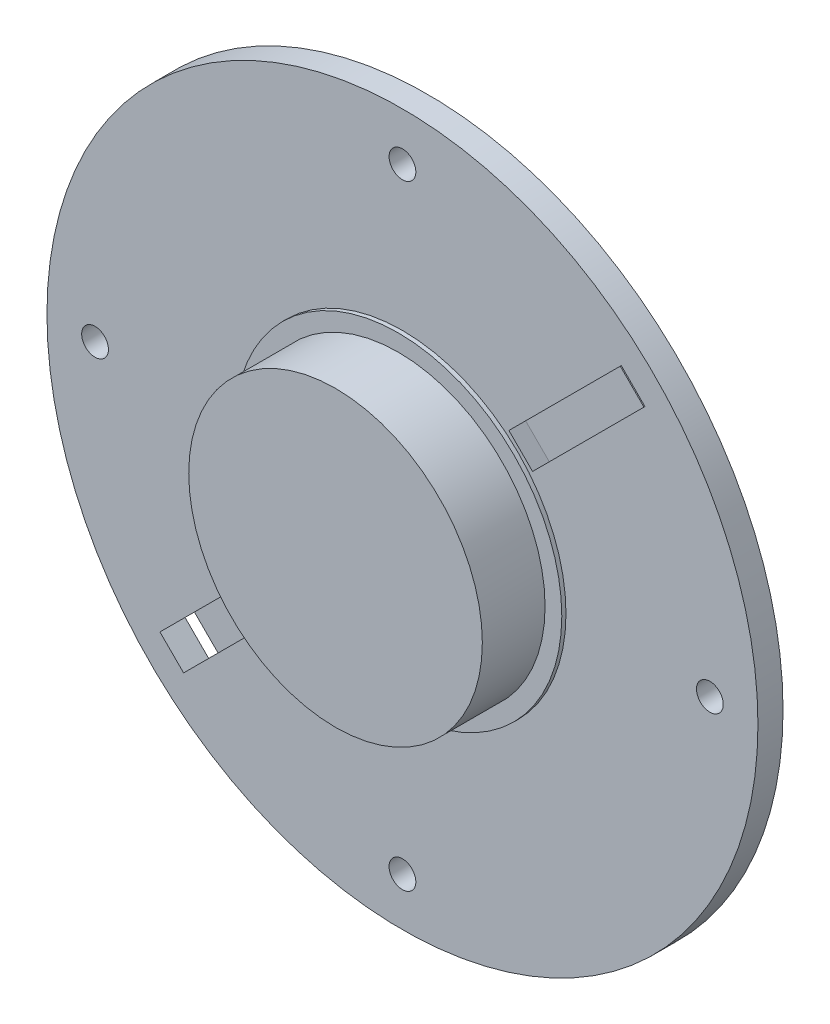
from build123d import *

# Parameters (mm, degrees)
SKETCH2_R           = 1.6
CUT_EXTRUDE1_DEPTH  = 62.102373113
SKETCH8_R           = 10
CUT_EXTRUDE6_DEPTH  = 2
SKETCH16_R          = 1.5
CUT_EXTRUDE7_DEPTH  = 4
CUT_EXTRUDE10_DEPTH = 2


with BuildPart() as part:
    # Sketch1 → Revolve1 (revolve)
    with BuildSketch(Plane(origin=(0, 0, 0), x_dir=(0, 0, -1), z_dir=(1, 0, 0)), mode=Mode.PRIVATE) as revolve1_sk:
        Polygon((0, 0), (0, 42.5), (-3, 42.5), (-3, 19.55), (-3.5, 19.55), (-3.5, 17.55), (-11, 17.55), (-11, 0), align=None)
    revolve(revolve1_sk.sketch.rotate(Axis((0, 0, 11), (0, 0, -1)), 90), axis=Axis((0, 0, 11), (0, 0, -1)))

    # Sketch2 → Cut-Extrude1 (cut, through all)
    with BuildSketch(Plane(origin=(0, 0, 0), x_dir=(-1, 0, 0), z_dir=(0, 0, -1))):
        with Locations(Location((0, 36.75, 0), (0, 0, 90))):
            Circle(SKETCH2_R)
        with Locations(Location((36.75, 0, 0), (0, 0, 90))):
            Circle(SKETCH2_R)
        with Locations(Location((0, -36.75, 0), (0, 0, 90))):
            Circle(SKETCH2_R)
        with Locations(Location((-36.75, 0, 0), (0, 0, 90))):
            Circle(SKETCH2_R)
    extrude(amount=-CUT_EXTRUDE1_DEPTH, mode=Mode.SUBTRACT)

    # Sketch8 → Cut-Extrude6 (cut)
    with BuildSketch(Plane(origin=(0, 0, 0), x_dir=(-1, 0, 0), z_dir=(0, 0, -1))):
        Circle(SKETCH8_R)
    extrude(amount=-CUT_EXTRUDE6_DEPTH, mode=Mode.SUBTRACT)

    # Sketch16 → Cut-Extrude7 (cut)
    with BuildSketch(Plane(origin=(0, 0, 2), x_dir=(-1, 0, 0), z_dir=(0, 0, -1))):
        with Locations((4.065863992, 4.065863992)):
            Circle(SKETCH16_R)
        with Locations((-4.065863992, -4.065863992)):
            Circle(SKETCH16_R)
    extrude(amount=-CUT_EXTRUDE7_DEPTH, mode=Mode.SUBTRACT)

    # Sketch19 → Cut-Extrude10 (cut, symmetric)
    with BuildSketch(Plane(origin=(0, 0, 0), x_dir=(0, 0, 1), z_dir=(-0.7071067811865487, 0.7071067811865465, 0))):
        Polygon((0, -15), (0, 15), (1, 20), (1, 36), (0, 36), (0, 39), (3, 39), (3, 20), (2, 15), (2, -15), (3, -20), (3, -39), (0, -39), (0, -36), (1, -36), (1, -20), align=None)
    extrude(amount=CUT_EXTRUDE10_DEPTH, both=True, mode=Mode.SUBTRACT)


solid = part.part
